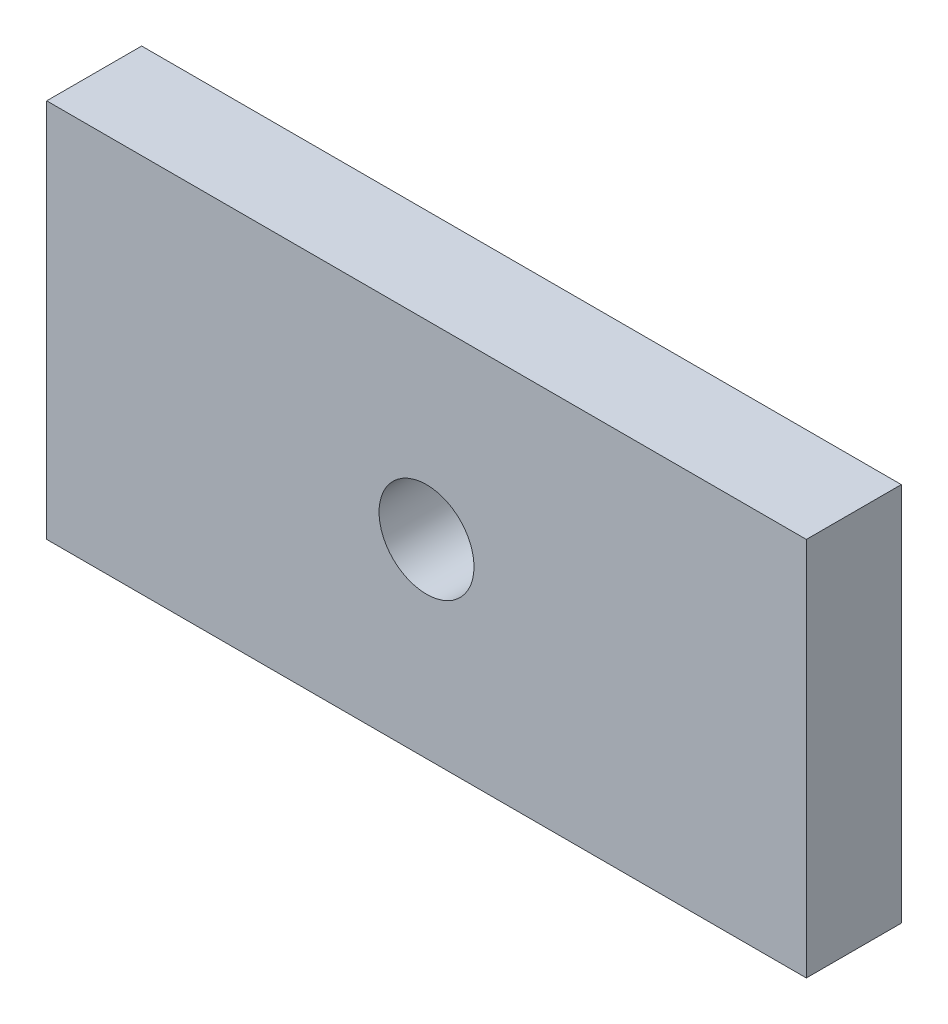
from build123d import *

# Parameters (mm, degrees)
SKETCH1_W           = 80
SKETCH1_H           = 40
SKETCH1_R           = 5
BOSS_EXTRUDE1_DEPTH = 10


with BuildPart() as part:
    # Sketch1 → Boss-Extrude1 (new body)
    with BuildSketch(Plane.XY):
        Rectangle(SKETCH1_W, SKETCH1_H)
        Circle(SKETCH1_R, mode=Mode.SUBTRACT)
    extrude(amount=BOSS_EXTRUDE1_DEPTH)


solid = part.part
